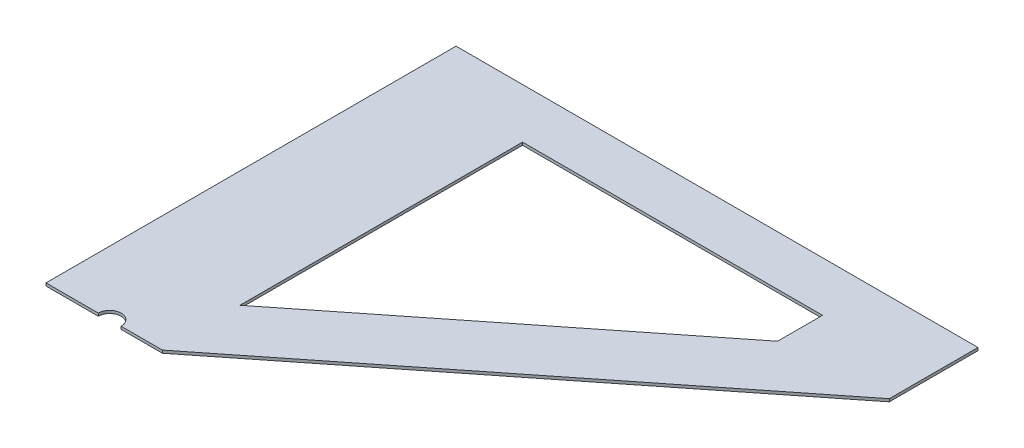
from build123d import *

# Parameters (mm, degrees)
BOSS_EXTRUDE1_DEPTH = 1.5875


with BuildPart() as part:
    # Sketch1 → Boss-Extrude1 (new, symmetric)
    with BuildSketch(Plane(origin=(0, 0, 0), x_dir=(1, 0, 0), z_dir=(0, 1, 0))):
        with BuildLine():
            Line((60.325, -1117.6), (525.1196, -749.3))
            Line((525.1196, -749.3), (525.1196, -647.7))
            Line((525.1196, -647.7), (-73.025, -647.7))
            Line((-73.025, -647.7), (-73.025, -1117.6))
            Line((-73.025, -1117.6), (-13.081, -1117.6))
            ThreePointArc((-13.081, -1117.6), (0, -1104.519), (13.081, -1117.6))
            Line((13.081, -1117.6), (60.325, -1117.6))
        make_face()
        Polygon((60.325, -1028.7), (60.325, -704.85), (404.076843973, -704.85), (404.076843973, -756.313435837), align=None, mode=Mode.SUBTRACT)
    extrude(amount=BOSS_EXTRUDE1_DEPTH, both=True)


solid = part.part
